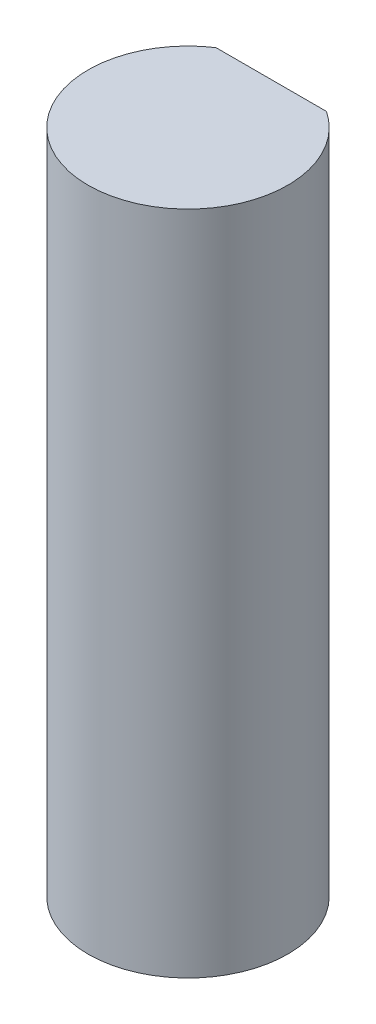
from build123d import *

# Parameters (mm, degrees)
SKETCH1_R           = 3
BOSS_EXTRUDE1_DEPTH = 20
SKETCH2_W           = 4.658312395
SKETCH2_H           = 7.838811761
CUT_EXTRUDE1_DEPTH  = 14


with BuildPart() as part:
    # Sketch1 → Boss-Extrude1 (new body)
    with BuildSketch(Plane(origin=(0, 0, 0), x_dir=(1, 0, 0), z_dir=(0, 1, 0))):
        with Locations(Location((0, 0, 0), (0, 0, 270))):
            Circle(SKETCH1_R)
    extrude(amount=BOSS_EXTRUDE1_DEPTH)

    # Sketch2 → Cut-Extrude1 (cut)
    with BuildSketch(Plane(origin=(0, 20, 0), x_dir=(1, 0, 0), z_dir=(0, 1, 0))):
        with Locations((0.670843802, 6.419405881)):
            Rectangle(SKETCH2_W, SKETCH2_H)
    extrude(amount=-CUT_EXTRUDE1_DEPTH, mode=Mode.SUBTRACT)


solid = part.part
